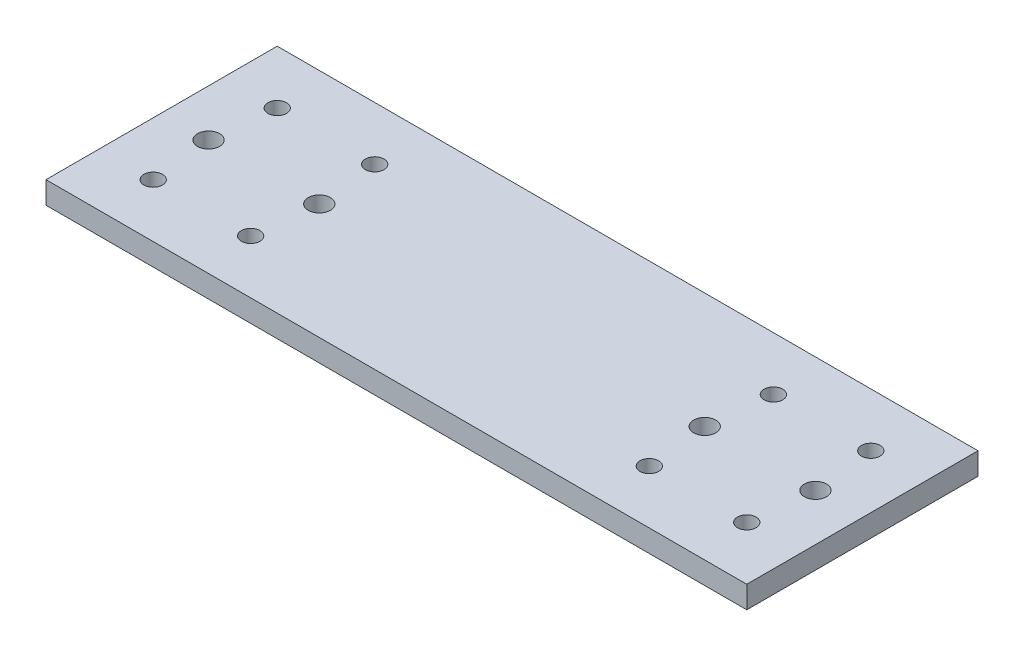
from build123d import *

# Parameters (mm, degrees)
SKETCH1_W           = 158.200000305
SKETCH1_H           = 52.2
SKETCH1_R           = 2.1
BOSS_EXTRUDE1_DEPTH = 5
SKETCH2_R           = 2.5
CUT_EXTRUDE1_DEPTH  = 10


with BuildPart() as part:
    # Sketch1 → Boss-Extrude1 (new body)
    with BuildSketch(Plane(origin=(0, 0, 0), x_dir=(1, 0, 0), z_dir=(0, 1, 0))):
        with Locations((56.000000153, 0)):
            Rectangle(SKETCH1_W, SKETCH1_H)
        with Locations(Location((-11, 14, 0), (0, 0, 270))):
            Circle(SKETCH1_R, mode=Mode.SUBTRACT)
        with Locations(Location((11, 14, 0), (0, 0, 270))):
            Circle(SKETCH1_R, mode=Mode.SUBTRACT)
        with Locations(Location((11, -14, 0), (0, 0, 270))):
            Circle(SKETCH1_R, mode=Mode.SUBTRACT)
        with Locations(Location((-11, -14, 0), (0, 0, 270))):
            Circle(SKETCH1_R, mode=Mode.SUBTRACT)
        with Locations(Location((123.000000305, -14, 0), (0, 0, 270))):
            Circle(SKETCH1_R, mode=Mode.SUBTRACT)
        with Locations(Location((101.000000305, -14, 0), (0, 0, 270))):
            Circle(SKETCH1_R, mode=Mode.SUBTRACT)
        with Locations(Location((101.000000305, 14, 0), (0, 0, 270))):
            Circle(SKETCH1_R, mode=Mode.SUBTRACT)
        with Locations(Location((123.000000305, 14, 0), (0, 0, 270))):
            Circle(SKETCH1_R, mode=Mode.SUBTRACT)
    extrude(amount=BOSS_EXTRUDE1_DEPTH)

    # Sketch2 → Cut-Extrude1 (cut)
    with BuildSketch(Plane(origin=(0, 5, 0), x_dir=(1, 0, 0), z_dir=(0, 1, 0))):
        with Locations(Location((12.5, 0, 0), (0, 0, 270))):
            Circle(SKETCH2_R)
        with Locations(Location((-12.5, 0, 0), (0, 0, 270))):
            Circle(SKETCH2_R)
        with Locations(Location((99.500000305, 0, 0), (0, 0, 270))):
            Circle(SKETCH2_R)
        with Locations(Location((124.500000305, 0, 0), (0, 0, 270))):
            Circle(SKETCH2_R)
    extrude(amount=-CUT_EXTRUDE1_DEPTH, mode=Mode.SUBTRACT)


solid = part.part
